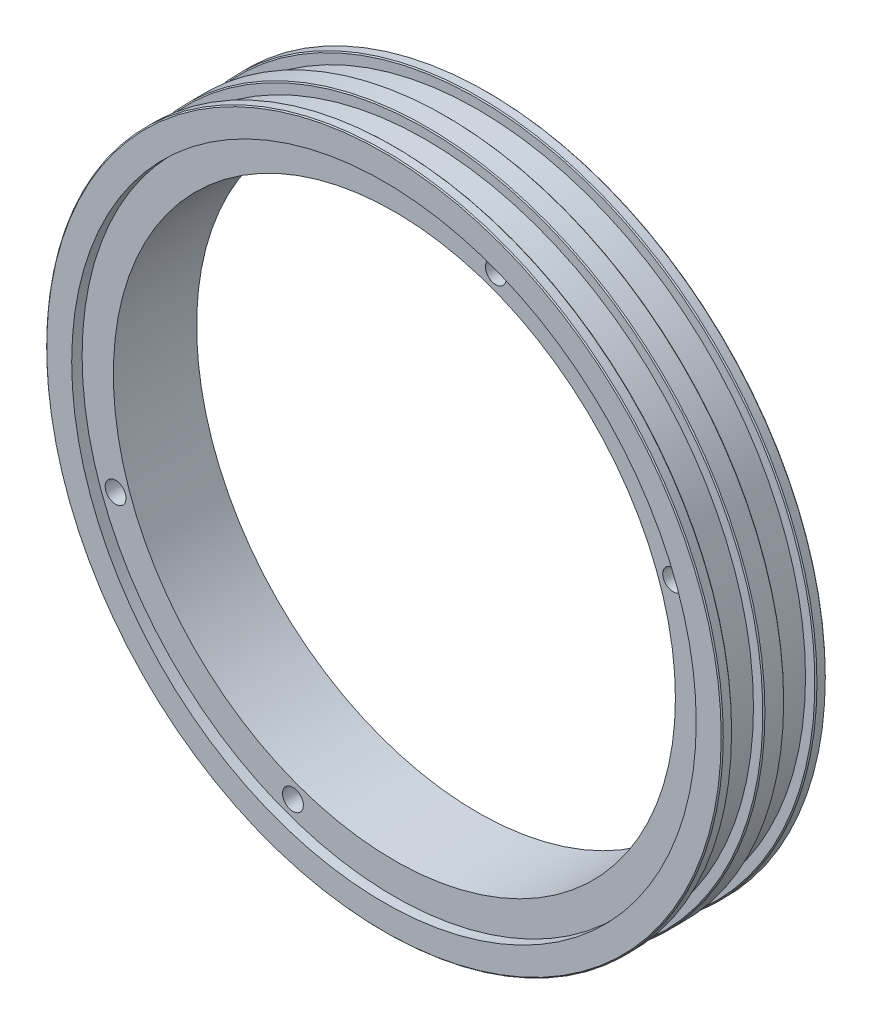
from build123d import *

# Parameters (mm, degrees)
SKETCH1_R           = 82.55
BOSS_EXTRUDE1_DEPTH = 25.4
SKETCH2_R           = 68.58
CUT_EXTRUDE1_DEPTH  = 25.4
SKETCH3_R           = 76.2
CUT_EXTRUDE2_DEPTH  = 2.54
CUT_EXTRUDE3_START  = -2.54
SKETCH4_R           = 76.2
CUT_EXTRUDE3_DEPTH  = 2.54
SKETCH5_W           = 2.54
SKETCH5_H           = 7.62
CHAMFER1_SIZE       = 0.254
CHAMFER2_SIZE       = 0.254
CHAMFER3_SIZE       = 0.254
CHAMFER4_SIZE       = 0.254
CHAMFER5_SIZE       = 0.254
CHAMFER6_SIZE       = 0.254
SKETCH6_R           = 2.54
CUT_EXTRUDE4_DEPTH  = 120.474537036


with BuildPart() as part:
    # Sketch1 → Boss-Extrude1 (new body)
    with BuildSketch(Plane.XY):
        Circle(SKETCH1_R)
    extrude(amount=BOSS_EXTRUDE1_DEPTH)

    # Sketch2 → Cut-Extrude1 (cut)
    with BuildSketch(Plane.XY):
        Circle(SKETCH2_R)
    extrude(amount=CUT_EXTRUDE1_DEPTH, mode=Mode.SUBTRACT)

    # Sketch3 → Cut-Extrude2 (cut)
    with BuildSketch(Plane.XY):
        Circle(SKETCH3_R)
    extrude(amount=CUT_EXTRUDE2_DEPTH, mode=Mode.SUBTRACT)

    # Sketch4 → Cut-Extrude3 (cut)
    with BuildSketch(Plane.XY.offset(25.4).offset(CUT_EXTRUDE3_START)):
        Circle(SKETCH4_R)
    extrude(amount=CUT_EXTRUDE3_DEPTH, mode=Mode.SUBTRACT)

    # Sketch5 → Cut-Revolve1 (revolve, cut)
    with BuildSketch(Plane(origin=(0, 0, 0), x_dir=(1, 0, 0), z_dir=(0, 1, 0))):
        with Locations((-81.28, -6.35)):
            Rectangle(SKETCH5_W, SKETCH5_H)
        with Locations((-81.28, -19.05)):
            Rectangle(SKETCH5_W, SKETCH5_H)
    revolve(axis=Axis((0, 0, 0), (0, 0, 1)), mode=Mode.SUBTRACT)

    # Chamfer1
    chamfer1_edges = [part.edges().sort_by_distance(p)[0] for p in [
        (-82.55, 0, 10.16),
    ]]
    chamfer(chamfer1_edges, length=CHAMFER1_SIZE)

    # Chamfer2
    chamfer2_edges = [part.edges().sort_by_distance(p)[0] for p in [
        (-82.55, 0, 15.24),
    ]]
    chamfer(chamfer2_edges, length=CHAMFER2_SIZE)

    # Chamfer3
    chamfer3_edges = [part.edges().sort_by_distance(p)[0] for p in [
        (-82.55, 0, 2.54),
    ]]
    chamfer(chamfer3_edges, length=CHAMFER3_SIZE)

    # Chamfer4
    chamfer4_edges = [part.edges().sort_by_distance(p)[0] for p in [
        (-82.55, 0, 22.86),
    ]]
    chamfer(chamfer4_edges, length=CHAMFER4_SIZE)

    # Chamfer5
    chamfer5_edges = [part.edges().sort_by_distance(p)[0] for p in [
        (-82.55, 0, 0),
    ]]
    chamfer(chamfer5_edges, length=CHAMFER5_SIZE)

    # Chamfer6
    chamfer6_edges = [part.edges().sort_by_distance(p)[0] for p in [
        (-82.55, 0, 25.4),
    ]]
    chamfer(chamfer6_edges, length=CHAMFER6_SIZE)

    # Sketch6 → Cut-Extrude4 (cut, through all)
    with BuildSketch(Plane.XY):
        with Locations((68.024348819, 24.758838175)):
            Circle(SKETCH6_R)
        with Locations((-68.024348819, -24.758838175)):
            Circle(SKETCH6_R)
        with Locations((24.758838175, 68.024348819)):
            Circle(SKETCH6_R)
        with Locations((-24.758838175, -68.024348819)):
            Circle(SKETCH6_R)
    extrude(amount=CUT_EXTRUDE4_DEPTH, mode=Mode.SUBTRACT)


solid = part.part
